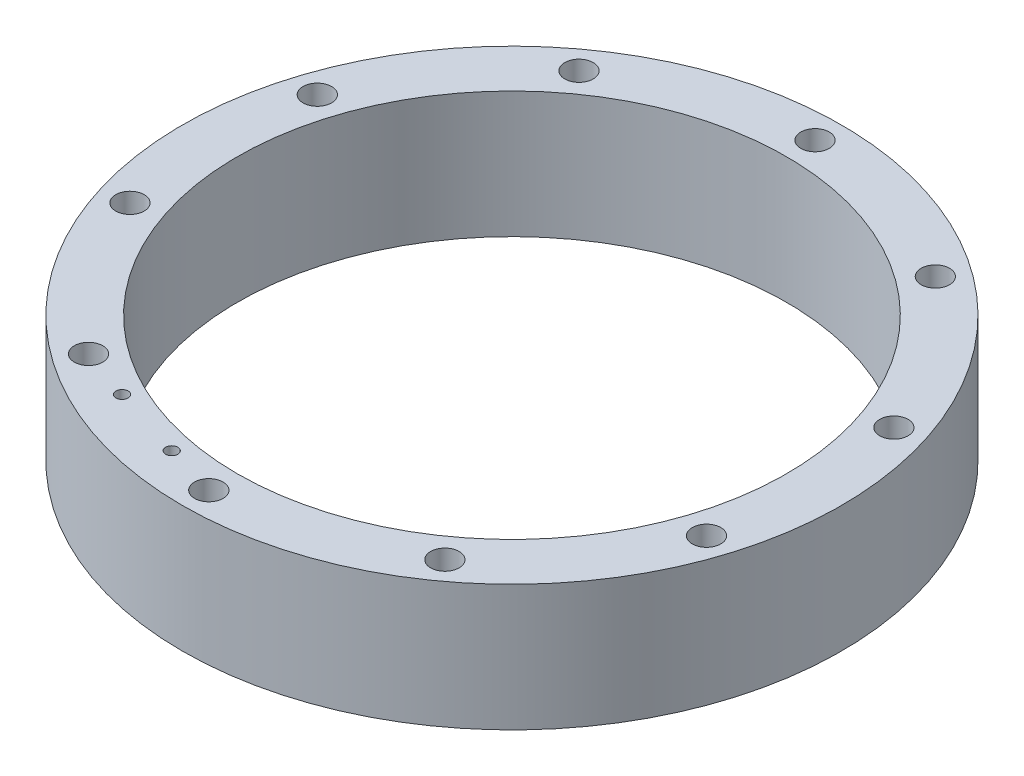
from build123d import *

# Parameters (mm, degrees)
SKETCH1_R           = 40.5
SKETCH1_R_2         = 1.75
SKETCH1_R_3         = 33.75
BOSS_EXTRUDE1_DEPTH = 15.5
SKETCH2_R           = 0.75
CUT_EXTRUDE1_DEPTH  = 60.335908184


with BuildPart() as part:
    # Sketch1 → Boss-Extrude1 (new body)
    with BuildSketch(Plane(origin=(0, 0, 0), x_dir=(1, 0, 0), z_dir=(0, 1, 0))):
        with Locations(Location((0, 0, 0), (0, 0, 270))):
            Circle(SKETCH1_R)
        with Locations(Location((0, 37.25, 0), (0, 0, 270))):
            Circle(SKETCH1_R_2, mode=Mode.SUBTRACT)
        with Locations(Location((21.895000648, 30.13588304, 0), (0, 0, 270))):
            Circle(SKETCH1_R_2, mode=Mode.SUBTRACT)
        with Locations(Location((35.426855232, 11.51088304, 0), (0, 0, 270))):
            Circle(SKETCH1_R_2, mode=Mode.SUBTRACT)
        with Locations(Location((35.426855232, -11.51088304, 0), (0, 0, 270))):
            Circle(SKETCH1_R_2, mode=Mode.SUBTRACT)
        with Locations(Location((21.895000648, -30.13588304, 0), (0, 0, 270))):
            Circle(SKETCH1_R_2, mode=Mode.SUBTRACT)
        with Locations(Location((0, -37.25, 0), (0, 0, 270))):
            Circle(SKETCH1_R_2, mode=Mode.SUBTRACT)
        with Locations(Location((-21.895000648, -30.13588304, 0), (0, 0, 270))):
            Circle(SKETCH1_R_2, mode=Mode.SUBTRACT)
        with Locations(Location((-35.426855232, -11.51088304, 0), (0, 0, 270))):
            Circle(SKETCH1_R_2, mode=Mode.SUBTRACT)
        with Locations(Location((-35.426855232, 11.51088304, 0), (0, 0, 270))):
            Circle(SKETCH1_R_2, mode=Mode.SUBTRACT)
        with Locations(Location((-21.895000648, 30.13588304, 0), (0, 0, 270))):
            Circle(SKETCH1_R_2, mode=Mode.SUBTRACT)
        with Locations(Location((0, 0, 0), (0, 0, 270))):
            Circle(SKETCH1_R_3, mode=Mode.SUBTRACT)
    extrude(amount=BOSS_EXTRUDE1_DEPTH)

    # Sketch2 → Cut-Extrude1 (cut, through all)
    with BuildSketch(Plane(origin=(0, 15.5, 0), x_dir=(1, 0, 0), z_dir=(0, 1, 0))):
        with Locations(Location((-6.483486619, -35.325442924, 0), (0, 0, 270))):
            Circle(SKETCH2_R)
        with Locations(Location((-15.518523524, -32.389781477, 0), (0, 0, 270))):
            Circle(SKETCH2_R)
    extrude(amount=-CUT_EXTRUDE1_DEPTH, mode=Mode.SUBTRACT)


solid = part.part
